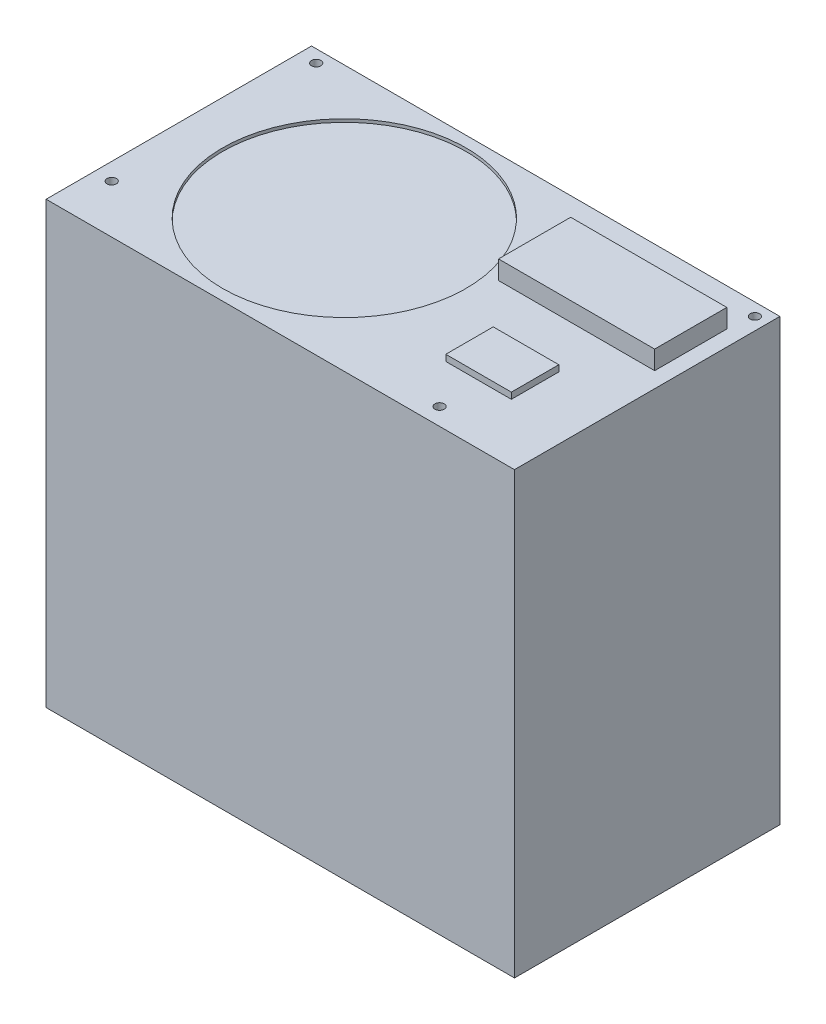
from build123d import *

# Parameters (mm, degrees)
ESQUISSE1_W             = 150
ESQUISSE1_H             = 141
BOSS_EXTRU_1_DEPTH      = 85
ESQUISSE2_W             = 21
ESQUISSE2_H             = 15.2
BOSS_EXTRU_2_DEPTH      = 2
ESQUISSE3_W             = 50
ESQUISSE3_H             = 23.11
BOSS_EXTRU_3_DEPTH      = 6
ESQUISSE4_R             = 39
ENL_V_MAT_EXTRU_1_DEPTH = 1
ESQUISSE5_R             = 1.5
ENL_V_MAT_EXTRU_2_DEPTH = 5
ESQUISSE6_R             = 12.5
BOSS_EXTRU_4_DEPTH      = 5


with BuildPart() as part:
    # Esquisse1 → Boss.-Extru.1 (new body)
    with BuildSketch(Plane.XY):
        with Locations((75, 70.5)):
            Rectangle(ESQUISSE1_W, ESQUISSE1_H)
    extrude(amount=BOSS_EXTRU_1_DEPTH)

    # Esquisse2 → Boss.-Extru.2 (add)
    with BuildSketch(Plane(origin=(0, 141, 0), x_dir=(1, 0, 0), z_dir=(0, 1, 0))):
        with Locations((119.5, -58.4)):
            Rectangle(ESQUISSE2_W, ESQUISSE2_H)
    extrude(amount=BOSS_EXTRU_2_DEPTH)

    # Esquisse3 → Boss.-Extru.3 (add)
    with BuildSketch(Plane(origin=(0, 141, 0), x_dir=(1, 0, 0), z_dir=(0, 1, 0))):
        with Locations((120, -23.555)):
            Rectangle(ESQUISSE3_W, ESQUISSE3_H)
    extrude(amount=BOSS_EXTRU_3_DEPTH)

    # Esquisse4 → Enlèv. mat.-Extru.1 (cut)
    with BuildSketch(Plane(origin=(0, 141, 0), x_dir=(1, 0, 0), z_dir=(0, 1, 0))):
        with Locations(Location((53, -42.5, 0), (0, 0, 270))):
            Circle(ESQUISSE4_R)
    extrude(amount=-ENL_V_MAT_EXTRU_1_DEPTH, mode=Mode.SUBTRACT)

    # Esquisse5 → Enlèv. mat.-Extru.2 (cut)
    with BuildSketch(Plane(origin=(0, 141, 0), x_dir=(1, 0, 0), z_dir=(0, 1, 0))):
        with Locations(Location((120.5, -79.5, 0), (0, 0, 270))):
            Circle(ESQUISSE5_R)
        with Locations(Location((5.5, -69.5, 0), (0, 0, 270))):
            Circle(ESQUISSE5_R)
        with Locations(Location((5.5, -4, 0), (0, 0, 270))):
            Circle(ESQUISSE5_R)
        with Locations(Location((146, -4, 0), (0, 0, 270))):
            Circle(ESQUISSE5_R)
    extrude(amount=-ENL_V_MAT_EXTRU_2_DEPTH, mode=Mode.SUBTRACT)

    # Esquisse6 → Boss.-Extru.4 (add)
    with BuildSketch(Plane(origin=(0, 0, 0), x_dir=(-1, 0, 0), z_dir=(0, -1, 0))):
        with Locations((-12.5, -18.5)):
            Circle(ESQUISSE6_R)
    extrude(amount=BOSS_EXTRU_4_DEPTH)


solid = part.part
